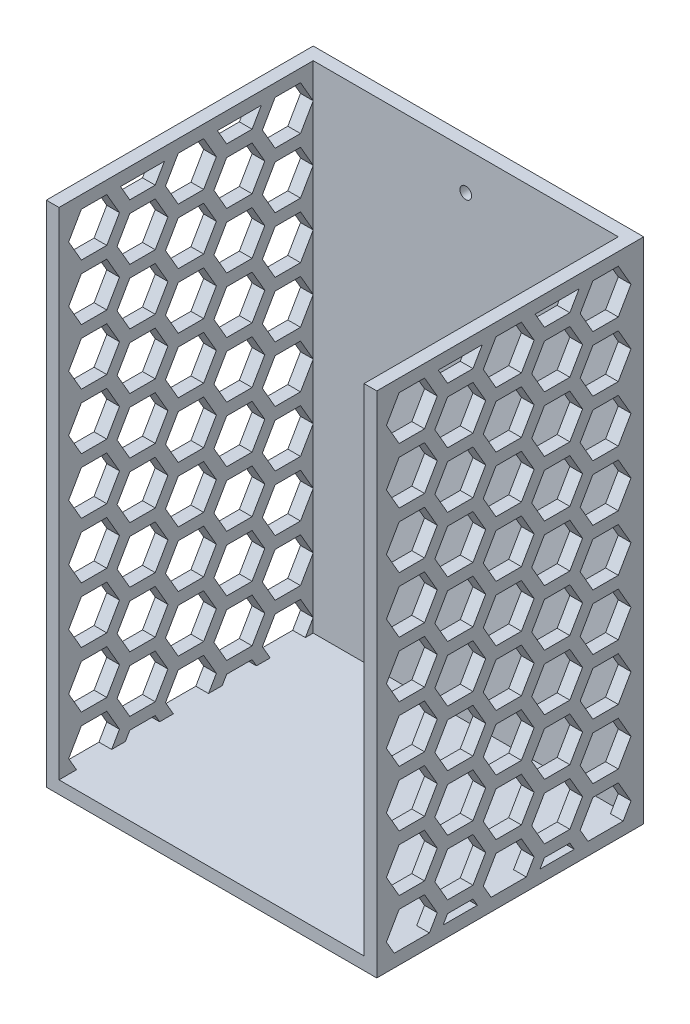
from build123d import *

# Parameters (mm, degrees)
SKETCH1_W           = 130
SKETCH1_H           = 200
BOSS_EXTRUDE1_DEPTH = 5
SKETCH2_R           = 2.3
CUT_EXTRUDE2_DEPTH  = 120.373363863
SKETCH3_W           = 130
SKETCH3_H           = 5
BOSS_EXTRUDE2_DEPTH = 100
SKETCH4_W           = 5
SKETCH4_H           = 195
BOSS_EXTRUDE3_DEPTH = 100
CUT_EXTRUDE3_DEPTH  = 195.743420942
BOSS_EXTRUDE4_DEPTH = 5
SKETCH7_W           = 105
SKETCH7_H           = 5
BOSS_EXTRUDE5_DEPTH = 130
BOSS_EXTRUDE6_DEPTH = 5


with BuildPart() as part:
    # Sketch1 → Boss-Extrude1 (new body)
    with BuildSketch(Plane.XY):
        Rectangle(SKETCH1_W, SKETCH1_H)
    extrude(amount=BOSS_EXTRUDE1_DEPTH)

    # Sketch2 → Cut-Extrude2 (cut, through all)
    with BuildSketch(Plane.XY):
        with Locations((0, 85)):
            Circle(SKETCH2_R)
        with Locations((0, -85)):
            Circle(SKETCH2_R)
    extrude(amount=CUT_EXTRUDE2_DEPTH, mode=Mode.SUBTRACT)

    # Sketch3 → Boss-Extrude2 (add)
    with BuildSketch(Plane.XY.offset(5)):
        with Locations((0, -97.5)):
            Rectangle(SKETCH3_W, SKETCH3_H)
    extrude(amount=BOSS_EXTRUDE2_DEPTH)

    # Sketch4 → Boss-Extrude3 (add)
    with BuildSketch(Plane.XY.offset(5)):
        with Locations((-62.5, 2.5)):
            Rectangle(SKETCH4_W, SKETCH4_H)
        with Locations((62.5, 2.5)):
            Rectangle(SKETCH4_W, SKETCH4_H)
    extrude(amount=BOSS_EXTRUDE3_DEPTH)

    # Sketch5 → Cut-Extrude3 (cut, through all)
    with BuildSketch(Plane.ZY.offset(65)):
        Polygon((20, -125), (10, -125), (5, -133.660254038), (10, -142.320508076), (20, -142.320508076), (25, -133.660254038), align=None)
        Polygon((20, 95), (10, 95), (5, 86.339745962), (10, 77.679491924), (20, 77.679491924), (25, 86.339745962), align=None)
        Polygon((39.052558883, 106), (29.052558883, 106), (24.052558883, 97.339745962), (29.052558883, 88.679491924), (39.052558883, 88.679491924), (44.052558883, 97.339745962), align=None)
        Polygon((58.105117767, 117), (48.105117767, 117), (43.105117767, 108.339745962), (48.105117767, 99.679491924), (58.105117767, 99.679491924), (63.105117767, 108.339745962), align=None)
        Polygon((77.15767665, 128), (67.15767665, 128), (62.15767665, 119.339745962), (67.15767665, 110.679491924), (77.15767665, 110.679491924), (82.15767665, 119.339745962), align=None)
        Polygon((96.210235533, 139), (86.210235533, 139), (81.210235533, 130.339745962), (86.210235533, 121.679491924), (96.210235533, 121.679491924), (101.210235533, 130.339745962), align=None)
        Polygon((39.052558883, 84), (29.052558883, 84), (24.052558883, 75.339745962), (29.052558883, 66.679491924), (39.052558883, 66.679491924), (44.052558883, 75.339745962), align=None)
        Polygon((58.105117767, 95), (48.105117767, 95), (43.105117767, 86.339745962), (48.105117767, 77.679491924), (58.105117767, 77.679491924), (63.105117767, 86.339745962), align=None)
        Polygon((77.15767665, 106), (67.15767665, 106), (62.15767665, 97.339745962), (67.15767665, 88.679491924), (77.15767665, 88.679491924), (82.15767665, 97.339745962), align=None)
        Polygon((96.210235533, 117), (86.210235533, 117), (81.210235533, 108.339745962), (86.210235533, 99.679491924), (96.210235533, 99.679491924), (101.210235533, 108.339745962), align=None)
        Polygon((39.052558883, 62), (29.052558883, 62), (24.052558883, 53.339745962), (29.052558883, 44.679491924), (39.052558883, 44.679491924), (44.052558883, 53.339745962), align=None)
        Polygon((58.105117767, 73), (48.105117767, 73), (43.105117767, 64.339745962), (48.105117767, 55.679491924), (58.105117767, 55.679491924), (63.105117767, 64.339745962), align=None)
        Polygon((77.15767665, 84), (67.15767665, 84), (62.15767665, 75.339745962), (67.15767665, 66.679491924), (77.15767665, 66.679491924), (82.15767665, 75.339745962), align=None)
        Polygon((96.210235533, 95), (86.210235533, 95), (81.210235533, 86.339745962), (86.210235533, 77.679491924), (96.210235533, 77.679491924), (101.210235533, 86.339745962), align=None)
        Polygon((39.052558883, 40), (29.052558883, 40), (24.052558883, 31.339745962), (29.052558883, 22.679491924), (39.052558883, 22.679491924), (44.052558883, 31.339745962), align=None)
        Polygon((58.105117767, 51), (48.105117767, 51), (43.105117767, 42.339745962), (48.105117767, 33.679491924), (58.105117767, 33.679491924), (63.105117767, 42.339745962), align=None)
        Polygon((77.15767665, 62), (67.15767665, 62), (62.15767665, 53.339745962), (67.15767665, 44.679491924), (77.15767665, 44.679491924), (82.15767665, 53.339745962), align=None)
        Polygon((96.210235533, 73), (86.210235533, 73), (81.210235533, 64.339745962), (86.210235533, 55.679491924), (96.210235533, 55.679491924), (101.210235533, 64.339745962), align=None)
        Polygon((39.052558883, 18), (29.052558883, 18), (24.052558883, 9.339745962), (29.052558883, 0.679491924), (39.052558883, 0.679491924), (44.052558883, 9.339745962), align=None)
        Polygon((58.105117767, 29), (48.105117767, 29), (43.105117767, 20.339745962), (48.105117767, 11.679491924), (58.105117767, 11.679491924), (63.105117767, 20.339745962), align=None)
        Polygon((77.15767665, 40), (67.15767665, 40), (62.15767665, 31.339745962), (67.15767665, 22.679491924), (77.15767665, 22.679491924), (82.15767665, 31.339745962), align=None)
        Polygon((96.210235533, 51), (86.210235533, 51), (81.210235533, 42.339745962), (86.210235533, 33.679491924), (96.210235533, 33.679491924), (101.210235533, 42.339745962), align=None)
        Polygon((39.052558883, -4), (29.052558883, -4), (24.052558883, -12.660254038), (29.052558883, -21.320508076), (39.052558883, -21.320508076), (44.052558883, -12.660254038), align=None)
        Polygon((58.105117767, 7), (48.105117767, 7), (43.105117767, -1.660254038), (48.105117767, -10.320508076), (58.105117767, -10.320508076), (63.105117767, -1.660254038), align=None)
        Polygon((77.15767665, 18), (67.15767665, 18), (62.15767665, 9.339745962), (67.15767665, 0.679491924), (77.15767665, 0.679491924), (82.15767665, 9.339745962), align=None)
        Polygon((96.210235533, 29), (86.210235533, 29), (81.210235533, 20.339745962), (86.210235533, 11.679491924), (96.210235533, 11.679491924), (101.210235533, 20.339745962), align=None)
        Polygon((39.052558883, -26), (29.052558883, -26), (24.052558883, -34.660254038), (29.052558883, -43.320508076), (39.052558883, -43.320508076), (44.052558883, -34.660254038), align=None)
        Polygon((58.105117767, -15), (48.105117767, -15), (43.105117767, -23.660254038), (48.105117767, -32.320508076), (58.105117767, -32.320508076), (63.105117767, -23.660254038), align=None)
        Polygon((77.15767665, -4), (67.15767665, -4), (62.15767665, -12.660254038), (67.15767665, -21.320508076), (77.15767665, -21.320508076), (82.15767665, -12.660254038), align=None)
        Polygon((96.210235533, 7), (86.210235533, 7), (81.210235533, -1.660254038), (86.210235533, -10.320508076), (96.210235533, -10.320508076), (101.210235533, -1.660254038), align=None)
        Polygon((39.052558883, -48), (29.052558883, -48), (24.052558883, -56.660254038), (29.052558883, -65.320508076), (39.052558883, -65.320508076), (44.052558883, -56.660254038), align=None)
        Polygon((58.105117767, -37), (48.105117767, -37), (43.105117767, -45.660254038), (48.105117767, -54.320508076), (58.105117767, -54.320508076), (63.105117767, -45.660254038), align=None)
        Polygon((77.15767665, -26), (67.15767665, -26), (62.15767665, -34.660254038), (67.15767665, -43.320508076), (77.15767665, -43.320508076), (82.15767665, -34.660254038), align=None)
        Polygon((96.210235533, -15), (86.210235533, -15), (81.210235533, -23.660254038), (86.210235533, -32.320508076), (96.210235533, -32.320508076), (101.210235533, -23.660254038), align=None)
        Polygon((39.052558883, -70), (29.052558883, -70), (24.052558883, -78.660254038), (29.052558883, -87.320508076), (39.052558883, -87.320508076), (44.052558883, -78.660254038), align=None)
        Polygon((58.105117767, -59), (48.105117767, -59), (43.105117767, -67.660254038), (48.105117767, -76.320508076), (58.105117767, -76.320508076), (63.105117767, -67.660254038), align=None)
        Polygon((77.15767665, -48), (67.15767665, -48), (62.15767665, -56.660254038), (67.15767665, -65.320508076), (77.15767665, -65.320508076), (82.15767665, -56.660254038), align=None)
        Polygon((96.210235533, -37), (86.210235533, -37), (81.210235533, -45.660254038), (86.210235533, -54.320508076), (96.210235533, -54.320508076), (101.210235533, -45.660254038), align=None)
        Polygon((39.052558883, -92), (29.052558883, -92), (24.052558883, -100.660254038), (29.052558883, -109.320508076), (39.052558883, -109.320508076), (44.052558883, -100.660254038), align=None)
        Polygon((58.105117767, -81), (48.105117767, -81), (43.105117767, -89.660254038), (48.105117767, -98.320508076), (58.105117767, -98.320508076), (63.105117767, -89.660254038), align=None)
        Polygon((77.15767665, -70), (67.15767665, -70), (62.15767665, -78.660254038), (67.15767665, -87.320508076), (77.15767665, -87.320508076), (82.15767665, -78.660254038), align=None)
        Polygon((96.210235533, -59), (86.210235533, -59), (81.210235533, -67.660254038), (86.210235533, -76.320508076), (96.210235533, -76.320508076), (101.210235533, -67.660254038), align=None)
        Polygon((20, 73), (10, 73), (5, 64.339745962), (10, 55.679491924), (20, 55.679491924), (25, 64.339745962), align=None)
        Polygon((20, 51), (10, 51), (5, 42.339745962), (10, 33.679491924), (20, 33.679491924), (25, 42.339745962), align=None)
        Polygon((20, 29), (10, 29), (5, 20.339745962), (10, 11.679491924), (20, 11.679491924), (25, 20.339745962), align=None)
        Polygon((20, 7), (10, 7), (5, -1.660254038), (10, -10.320508076), (20, -10.320508076), (25, -1.660254038), align=None)
        Polygon((20, -15), (10, -15), (5, -23.660254038), (10, -32.320508076), (20, -32.320508076), (25, -23.660254038), align=None)
        Polygon((20, -37), (10, -37), (5, -45.660254038), (10, -54.320508076), (20, -54.320508076), (25, -45.660254038), align=None)
        Polygon((20, -59), (10, -59), (5, -67.660254038), (10, -76.320508076), (20, -76.320508076), (25, -67.660254038), align=None)
        Polygon((20, -81), (10, -81), (5, -89.660254038), (10, -98.320508076), (20, -98.320508076), (25, -89.660254038), align=None)
        Polygon((20, -103), (10, -103), (5, -111.660254038), (10, -120.320508076), (20, -120.320508076), (25, -111.660254038), align=None)
        Polygon((39.052558883, -114), (29.052558883, -114), (24.052558883, -122.660254038), (29.052558883, -131.320508076), (39.052558883, -131.320508076), (44.052558883, -122.660254038), align=None)
        Polygon((58.105117767, -103), (48.105117767, -103), (43.105117767, -111.660254038), (48.105117767, -120.320508076), (58.105117767, -120.320508076), (63.105117767, -111.660254038), align=None)
        Polygon((77.15767665, -92), (67.15767665, -92), (62.15767665, -100.660254038), (67.15767665, -109.320508076), (77.15767665, -109.320508076), (82.15767665, -100.660254038), align=None)
        Polygon((96.210235533, -81), (86.210235533, -81), (81.210235533, -89.660254038), (86.210235533, -98.320508076), (96.210235533, -98.320508076), (101.210235533, -89.660254038), align=None)
    extrude(amount=-CUT_EXTRUDE3_DEPTH, mode=Mode.SUBTRACT)

    # Sketch6 → Boss-Extrude4 (add)
    with BuildSketch(Plane.ZY.offset(65)):
        Polygon((105, 100), (105, -100), (0, -100), (0, -95), (102, -95), (102, 95), (0, 95), (0, 100), align=None)
    extrude(amount=-BOSS_EXTRUDE4_DEPTH)

    # Sketch7 → Boss-Extrude5 (add)
    with BuildSketch(Plane(origin=(65, 0, 0), x_dir=(0, 0, -1), z_dir=(1, 0, 0))):
        with Locations((-52.5, -97.5)):
            Rectangle(SKETCH7_W, SKETCH7_H)
    extrude(amount=-BOSS_EXTRUDE5_DEPTH)

    # Sketch8 → Boss-Extrude6 (add)
    with BuildSketch(Plane(origin=(65, 0, 0), x_dir=(0, 0, -1), z_dir=(1, 0, 0))):
        Polygon((-105, 100), (-105, -100), (-102, -100), (-102, 95), (0, 95), (0, 100), align=None)
    extrude(amount=-BOSS_EXTRUDE6_DEPTH)


solid = part.part
